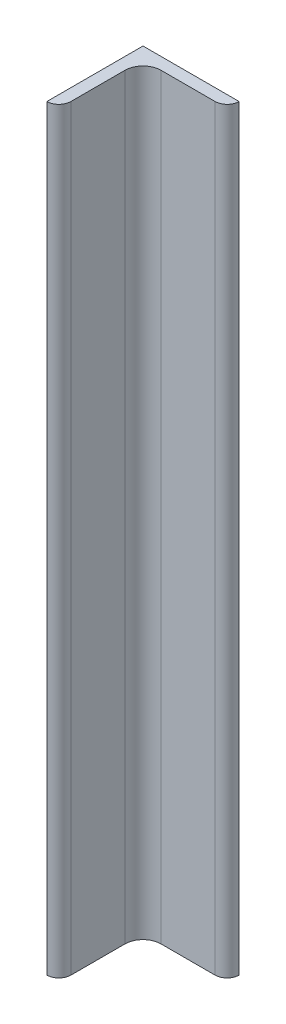
from build123d import *

# Parameters (mm, degrees)
HIERRO_ANGULAR_1_X_1_X_0_125_1_DEPTH = 200


with BuildPart() as part:
    # Sketch1 → Hierro angular 1 X 1 X 0.125(1) (new body)
    with BuildSketch(Plane.ZX):
        with BuildLine():
            Line((0, 0), (0, 25.4))
            Line((0, 25.4), (0.00508, 25.4))
            ThreePointArc((0.00508, 25.4), (2.246551928, 24.471551928), (3.175, 22.23008))
            Line((3.175, 22.23008), (3.175, 7.9375))
            ThreePointArc((3.175, 7.9375), (4.569903955, 4.569903955), (7.9375, 3.175))
            Line((7.9375, 3.175), (22.23008, 3.175))
            ThreePointArc((22.23008, 3.175), (24.471551928, 2.246551928), (25.4, 0.00508))
            Line((25.4, 0.00508), (25.4, 0))
            Line((25.4, 0), (0, 0))
        make_face()
    extrude(amount=HIERRO_ANGULAR_1_X_1_X_0_125_1_DEPTH)


solid = part.part
